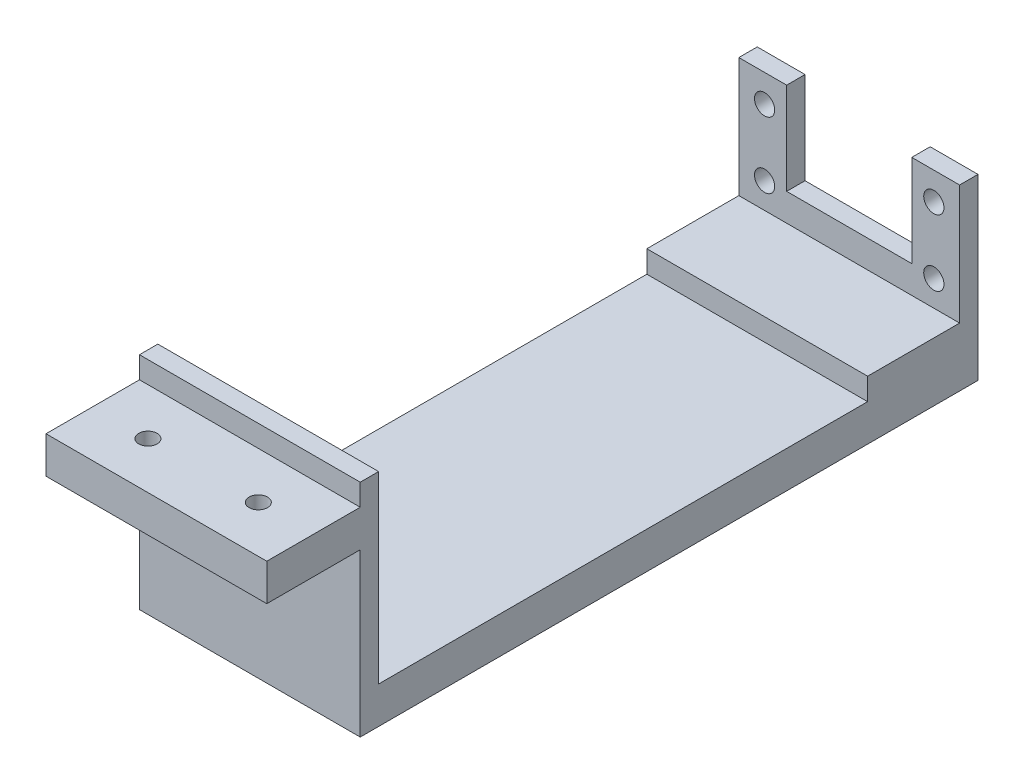
from build123d import *

# Parameters (mm, degrees)
SKETCH1_R                = 2.75
BOSS_EXTRUDE1_DEPTH      = 5
BOSS_EXTRUDE2_DEPTH      = 25
BOSS_EXTRUDE2_DEPTH_BACK = 5
SKETCH2_W                = 60
SKETCH2_H                = 6
SKETCH3_W                = 60
SKETCH3_H                = 10
BOSS_EXTRUDE3_DEPTH      = 167.8942
SKETCH4_W                = 60
SKETCH4_H                = 5
BOSS_EXTRUDE4_DEPTH      = 50
SKETCH5_W                = 60
SKETCH5_H                = 10
BOSS_EXTRUDE5_DEPTH      = 25.4
M5X0_8_TAPPED_HOLE1_D    = 5


with BuildPart() as part:
    # Sketch1 → Boss-Extrude1 (new body)
    # profile 1 of 2: a face of its own
    with BuildSketch(Plane.XY):
        Polygon((13, 7.5), (13, 32.5), (0, 32.5), (0, 0), (30, 0), (30, 7.5), align=None)
        with Locations((7, 7)):
            Circle(SKETCH1_R, mode=Mode.SUBTRACT)
        with Locations((7, 25)):
            Circle(SKETCH1_R, mode=Mode.SUBTRACT)
    # profile 2 of 2: a face of its own
    with BuildSketch(Plane.XY):
        Polygon((47, 7.5), (30, 7.5), (30, 0), (60, 0), (60, 32.5), (47, 32.5), align=None)
        with Locations((53, 7)):
            Circle(SKETCH1_R, mode=Mode.SUBTRACT)
        with Locations((53, 25)):
            Circle(SKETCH1_R, mode=Mode.SUBTRACT)
    extrude(amount=BOSS_EXTRUDE1_DEPTH)

    # Sketch2 → Boss-Extrude2 (add, two sides: drawn at the far end of the back side and taken through both)
    with BuildSketch(Plane.XY.offset(5).offset(-BOSS_EXTRUDE2_DEPTH_BACK)):
        with Locations((30, -3)):
            Rectangle(SKETCH2_W, SKETCH2_H)
    extrude(amount=BOSS_EXTRUDE2_DEPTH + BOSS_EXTRUDE2_DEPTH_BACK)

    # Sketch3 → Boss-Extrude3 (add)
    with BuildSketch(Plane(origin=(0, 0, 0), x_dir=(-1, 0, 0), z_dir=(0, 0, -1))):
        with Locations((-30, -11)):
            Rectangle(SKETCH3_W, SKETCH3_H)
    extrude(amount=-BOSS_EXTRUDE3_DEPTH)

    # Sketch4 → Boss-Extrude4 (add)
    with BuildSketch(Plane(origin=(0, -6, 0), x_dir=(1, 0, 0), z_dir=(0, 1, 0))):
        with Locations((30, -165.3942)):
            Rectangle(SKETCH4_W, SKETCH4_H)
    extrude(amount=BOSS_EXTRUDE4_DEPTH)

    # Sketch5 → Boss-Extrude5 (add)
    with BuildSketch(Plane.XY.offset(167.8942)):
        with Locations((30, 33.0996)):
            Rectangle(SKETCH5_W, SKETCH5_H)
    extrude(amount=BOSS_EXTRUDE5_DEPTH)

    # M5x0.8 Tapped Hole1 (through all)
    with Locations(Plane(origin=(0, 38.0996, 0), x_dir=(1, 0, 0), z_dir=(0, 1, 0))):
        with Locations((45, -180.5942), (15, -180.5942)):
            Hole(M5X0_8_TAPPED_HOLE1_D / 2)


solid = part.part
